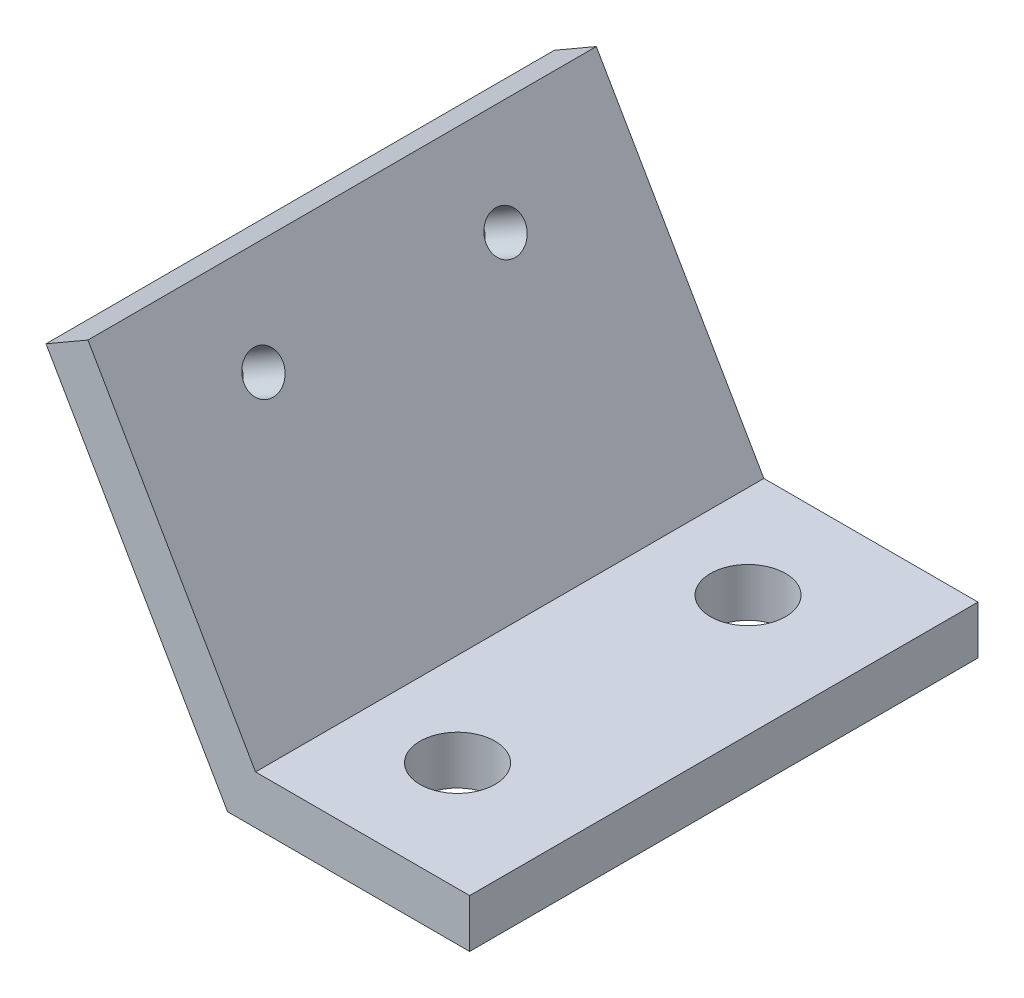
from build123d import *

# Parameters (mm, degrees)
BOSS_EXTRUDE1_DEPTH     = 42
CUT_EXTRUDE1_DEPTH      = 53.543429003
CUT_EXTRUDE1_DEPTH_BACK = 53.543429003
SKETCH4_R               = 1.6
SKETCH5_R               = 3.1
CUT_EXTRUDE2_DEPTH      = 71.830895708


with BuildPart() as part:
    # Sketch1 → Boss-Extrude1 (new body)
    with BuildSketch(Plane.XY):
        Polygon((-32.390626472, -27.785925208), (-14.700027549, -27.785925208), (-14.700027549, -31.785925208), (-34.700027549, -31.785925208), (-49.700027549, -5.805163094), (-46.235925934, -3.805163094), align=None)
    extrude(amount=BOSS_EXTRUDE1_DEPTH)

    # Sketch4 → Cut-Extrude1 (cut, two sides: drawn at the far end of the back side and taken through both)
    with BuildSketch(Plane(origin=(-39.788730018, -22.972033987, 0), x_dir=(0, 0, 1), z_dir=(-0.8660254037844377, -0.5000000000000018, 0)).offset(-CUT_EXTRUDE1_DEPTH_BACK)):
        with Locations(Location((31, 12.822595062, 0), (0, 0, 270))):
            Circle(SKETCH4_R)
        with Locations(Location((11, 12.822595062, 0), (0, 0, 270))):
            Circle(SKETCH4_R)
    extrude(amount=CUT_EXTRUDE1_DEPTH + CUT_EXTRUDE1_DEPTH_BACK, mode=Mode.SUBTRACT)

    # Sketch5 → Cut-Extrude2 (cut, through all)
    with BuildSketch(Plane.XZ.offset(31.785925208)):
        with Locations((-24.700027549, 33)):
            Circle(SKETCH5_R)
        with Locations((-24.700027549, 9)):
            Circle(SKETCH5_R)
    extrude(amount=-CUT_EXTRUDE2_DEPTH, mode=Mode.SUBTRACT)


solid = part.part
